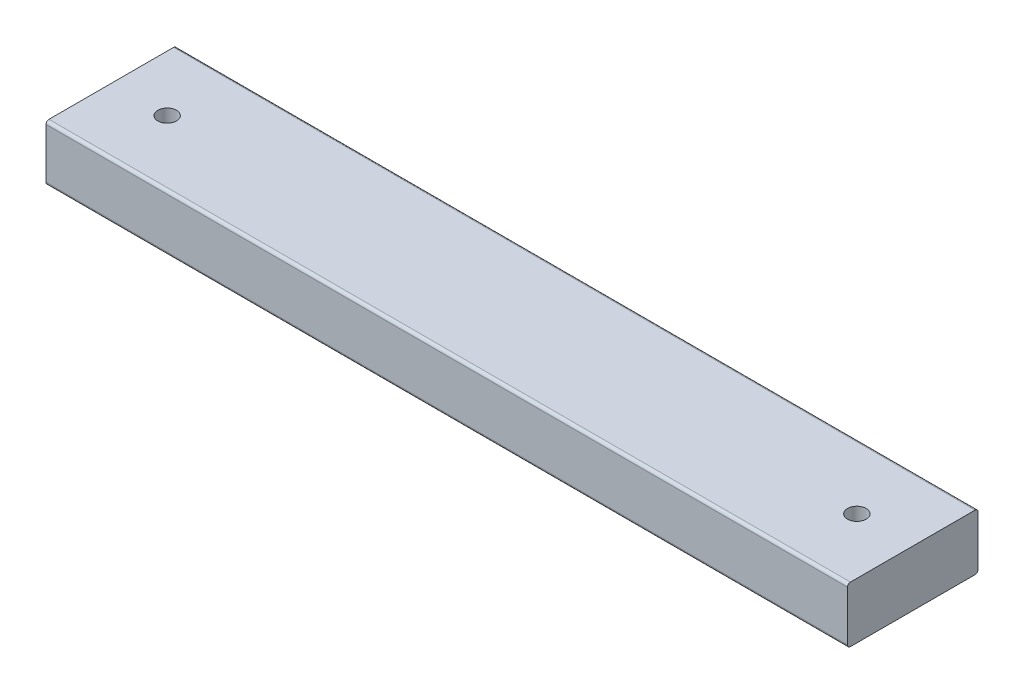
from build123d import *

# Parameters (mm, degrees)
SKETCH1_W           = 88.9
SKETCH1_H           = 38.1
BOSS_EXTRUDE1_DEPTH = 546.1
FILLET1_R           = 2
SKETCH2_R           = 6.35
CUT_EXTRUDE1_DEPTH  = 550.229116581


with BuildPart() as part:
    # Sketch1 → Boss-Extrude1 (new body)
    with BuildSketch(Plane(origin=(0, 0, 0), x_dir=(0, 0, -1), z_dir=(1, 0, 0))):
        Rectangle(SKETCH1_W, SKETCH1_H)
    extrude(amount=BOSS_EXTRUDE1_DEPTH)

    # Fillet1
    fillet1_edges = [part.edges().sort_by_distance(p)[0] for p in [
        (273.05, -19.05, -44.45),
        (273.05, -19.05, 44.45),
        (273.05, 19.05, 44.45),
        (273.05, 19.05, -44.45),
    ]]
    fillet(fillet1_edges, radius=FILLET1_R)

    # Sketch2 → Cut-Extrude1 (cut, through all)
    with BuildSketch(Plane(origin=(0, 19.05, 0), x_dir=(1, 0, 0), z_dir=(0, 1, 0))):
        with Locations(Location((38.1, 0, 0), (0, 0, 270))):
            Circle(SKETCH2_R)
        with Locations(Location((508, 0, 0), (0, 0, 270))):
            Circle(SKETCH2_R)
    extrude(amount=-CUT_EXTRUDE1_DEPTH, mode=Mode.SUBTRACT)


solid = part.part
